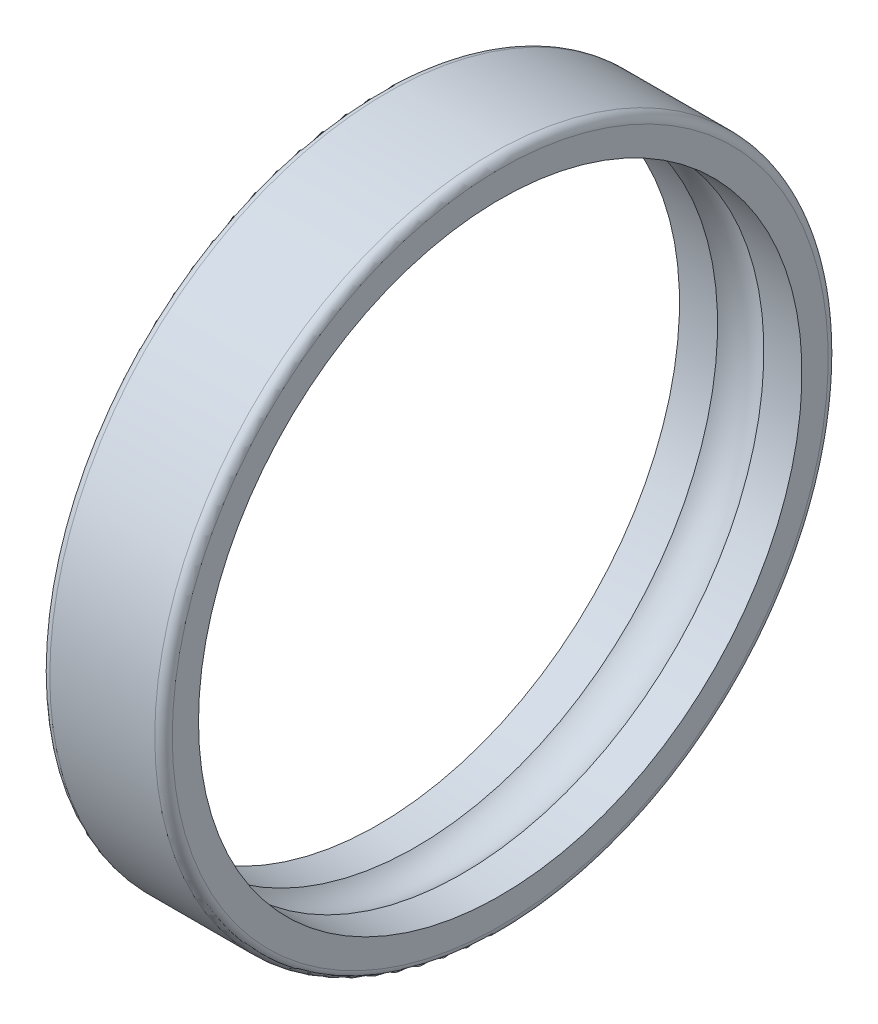
from build123d import *


with BuildPart() as part:
    # Esquisse1 → Base-Révolution (revolve)
    with BuildSketch(Plane.XY, mode=Mode.PRIVATE) as base_r_volution_sk:
        with BuildLine():
            Line((-4.285714286, 27.5), (4.285714286, 27.5))
            ThreePointArc((4.285714286, 27.5), (4.790790558, 27.290790558), (5, 26.785714286))
            Line((5, 26.785714286), (5, 24.642857143))
            Line((5, 24.642857143), (1.889822365, 24.642857143))
            ThreePointArc((1.889822365, 24.642857143), (0, 25.357142857), (-1.889822365, 24.642857143))
            Line((-1.889822365, 24.642857143), (-5, 24.642857143))
            Line((-5, 24.642857143), (-5, 26.785714286))
            ThreePointArc((-5, 26.785714286), (-4.790790558, 27.290790558), (-4.285714286, 27.5))
        make_face()
    revolve(base_r_volution_sk.sketch.rotate(Axis((0, 0, 0), (1, 0, 0)), 90), axis=Axis((0, 0, 0), (1, 0, 0)))


solid = part.part
